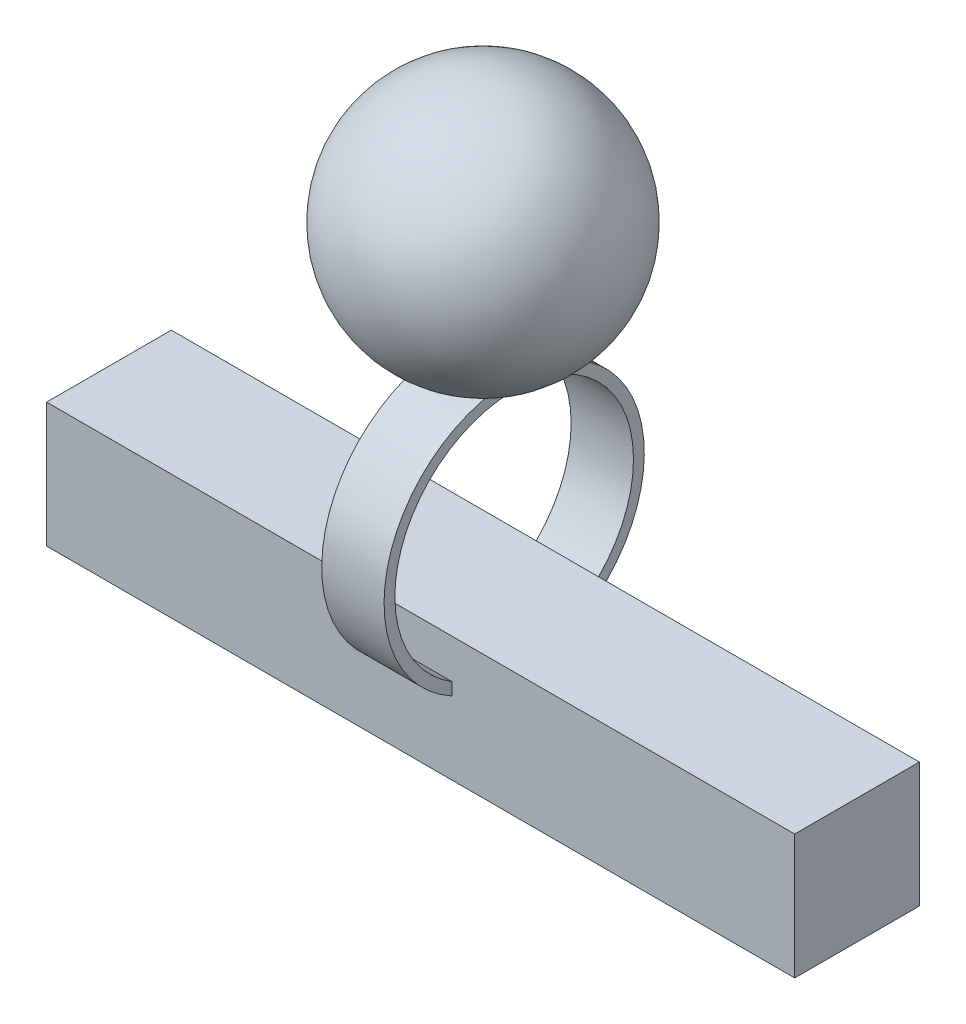
from build123d import *

# Parameters (mm, degrees)
SKETCH1_W           = 5
SKETCH1_H           = 5
BOSS_EXTRUDE1_DEPTH = 15
SKETCH5_W           = 2.5
SKETCH5_H           = 0.5


with BuildPart() as part:
    # Sketch1 → Boss-Extrude1 (new, symmetric)
    with BuildSketch(Plane(origin=(0, 0, 0), x_dir=(0, 0, -1), z_dir=(1, 0, 0))):
        Rectangle(SKETCH1_W, SKETCH1_H)
    extrude(amount=BOSS_EXTRUDE1_DEPTH, both=True)


with BuildPart() as body_2:
    # Sketch3 → Revolve1 (revolve)
    with BuildSketch(Plane(origin=(0, 0, 0), x_dir=(0, 0, -1), z_dir=(1, 0, 0))):
        with BuildLine():
            Line((0, 10), (0, 20))
            ThreePointArc((0, 20), (-5, 15), (0, 10))
        make_face()
    revolve(axis=Axis((0, 10, 0), (0, 1, 0)))


with BuildPart() as body_3:
    # Sweep1: sweep along a path in Sketch4
    with BuildLine(Plane(origin=(0, 0, 0), x_dir=(0, 0, -1), z_dir=(1, 0, 0))) as sweep1_path:
        CenterArc((0, 5), 5, 0, 360)
    # Sketch5 → Sweep1 (sweep)
    with BuildSketch(Plane.XY.offset(2.5)):
        with Locations((0, 0.669872981)):
            Rectangle(SKETCH5_W, SKETCH5_H)
    sweep(path=sweep1_path.line)


solid = Compound([part.part, body_2.part, body_3.part])
